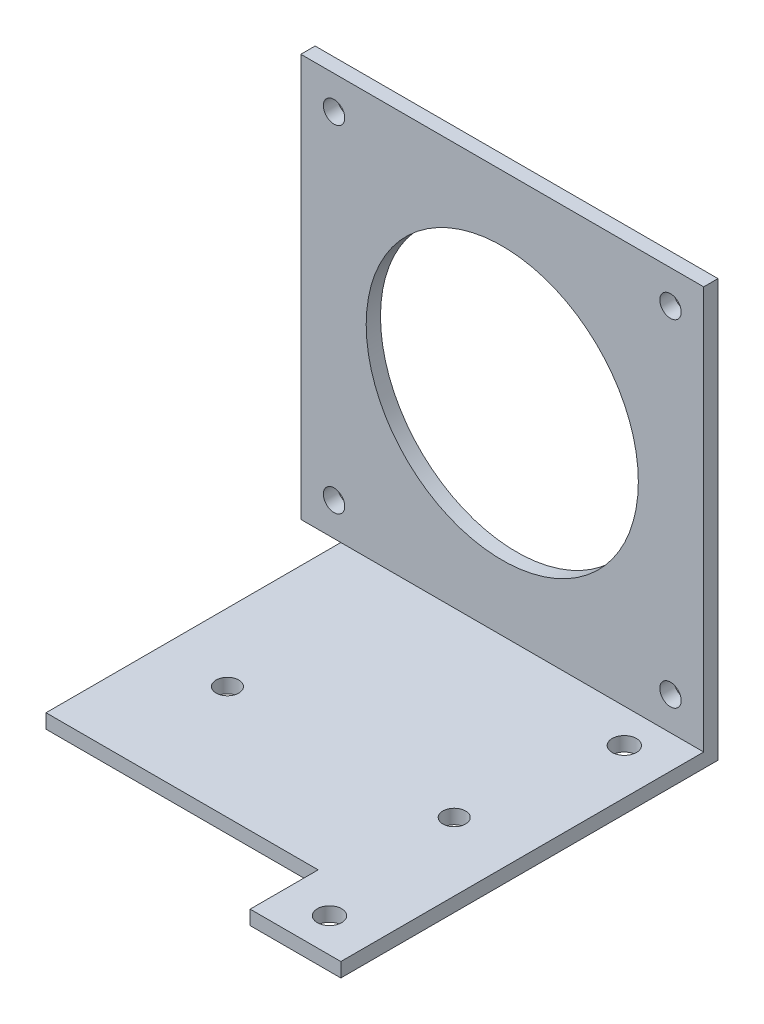
from build123d import *

# Parameters (mm, degrees)
SKETCH1_R           = 1.7
SKETCH1_R_2         = 1.5875
BOSS_EXTRUDE1_DEPTH = 2
SKETCH2_W           = 56.4
SKETCH2_H           = 2
BOSS_EXTRUDE2_DEPTH = 56.4
SKETCH3_R           = 19.05
SKETCH3_R_2         = 1.5
CUT_EXTRUDE1_DEPTH  = 94.696531419


with BuildPart() as part:
    # Sketch1 → Boss-Extrude1 (new body)
    with BuildSketch(Plane(origin=(0, 0, 0), x_dir=(1, 0, 0), z_dir=(0, 1, 0))):
        Polygon((0, 43.275), (50.8, 43.275), (50.8, -9.525), (38.1, -9.525), (38.1, 0), (0, 0), align=None)
        with Locations(Location((44.45, 36.5125, 0), (0, 0, 270))):
            Circle(SKETCH1_R, mode=Mode.SUBTRACT)
        with Locations(Location((44.45, -4.7625, 0), (0, 0, 270))):
            Circle(SKETCH1_R, mode=Mode.SUBTRACT)
        with Locations(Location((9.525, 15.875, 0), (0, 0, 270))):
            Circle(SKETCH1_R_2, mode=Mode.SUBTRACT)
        with Locations(Location((41.275, 15.875, 0), (0, 0, 270))):
            Circle(SKETCH1_R_2, mode=Mode.SUBTRACT)
    extrude(amount=BOSS_EXTRUDE1_DEPTH)

    # Sketch2 → Boss-Extrude2 (add)
    with BuildSketch(Plane(origin=(0, 2, 0), x_dir=(1, 0, 0), z_dir=(0, 1, 0))):
        with Locations((22.6, 42.275)):
            Rectangle(SKETCH2_W, SKETCH2_H)
    extrude(amount=BOSS_EXTRUDE2_DEPTH)

    # Sketch3 → Cut-Extrude1 (cut, through all)
    with BuildSketch(Plane(origin=(0, 0, -43.275), x_dir=(-1, 0, 0), z_dir=(0, 0, -1))):
        with Locations((-22.6, 30.2)):
            Circle(SKETCH3_R)
        with Locations((0.95, 53.75)):
            Circle(SKETCH3_R_2)
        with Locations((0.95, 6.65)):
            Circle(SKETCH3_R_2)
        with Locations((-46.15, 6.65)):
            Circle(SKETCH3_R_2)
        with Locations((-46.15, 53.75)):
            Circle(SKETCH3_R_2)
    extrude(amount=-CUT_EXTRUDE1_DEPTH, mode=Mode.SUBTRACT)


solid = part.part
